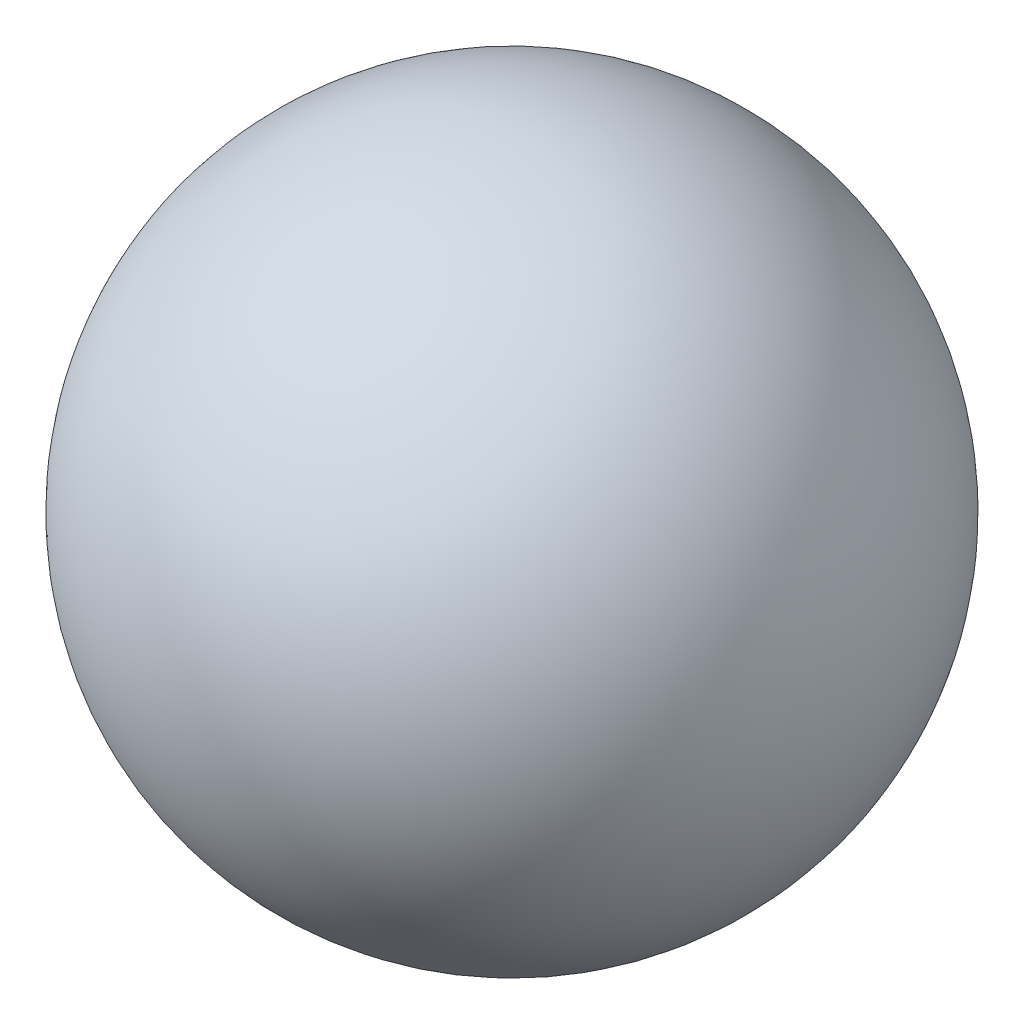
from build123d import *


with BuildPart() as part:
    # Çizim1 → Döndür1 (revolve)
    with BuildSketch(Plane.XY):
        with BuildLine():
            Line((-12, 0), (12, 0))
            ThreePointArc((12, 0), (0, -12), (-12, 0))
        make_face()
    revolve(axis=Axis((-12, 0, 0), (1, 0, 0)))


solid = part.part
